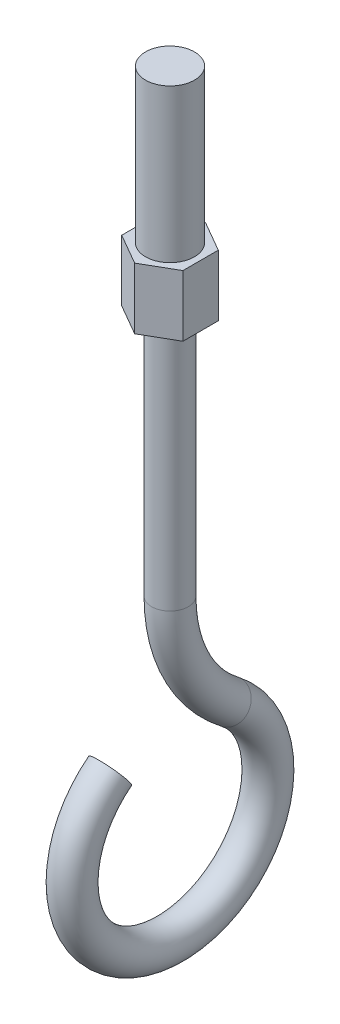
from build123d import *

# Parameters (mm, degrees)
SWEEP1_PROFILE_R    = 3.81
SKETCH32_R          = 5.08
BOSS_EXTRUDE1_DEPTH = 12.7
SKETCH32_2_R        = 5.08
SKETCH32_2_R_2      = 3.81
BOSS_EXTRUDE2_DEPTH = 44.45


with BuildPart() as part:
    # Sweep1: sweep along a path in Sketch1
    with BuildLine(Plane(origin=(0, 0, 0), x_dir=(0, 0, -1), z_dir=(1, 0, 0))) as sweep1_path:
        Line((0, 0), (0, -50.8))
        ThreePointArc((0, -50.8), (3.265488804, -64.824803812), (12.390243902, -75.964704327))
        ThreePointArc((12.390243902, -75.964704327), (0, -112.390115096), (-12.390243902, -75.964704327))
    # Sweep1 profile (on start of the path) → Sweep1 (sweep)
    with BuildSketch(Plane(origin=(0, 0, 0), x_dir=(0, 0, -1), z_dir=(0, -1, 0))):
        Circle(SWEEP1_PROFILE_R)
    sweep(path=sweep1_path.line)



with BuildPart() as body_2:
    # Sketch32 → Boss-Extrude1 (new body)
    with BuildSketch(Plane(origin=(0, 0, 0), x_dir=(1, 0, 0), z_dir=(0, 1, 0))):
        Polygon((6.35, 3.666174209), (0, 7.332348419), (-6.35, 3.666174209), (-6.35, -3.666174209), (0, -7.332348419), (6.35, -3.666174209), align=None)
        with Locations(Location((0, 0, 0), (0, 0, 90))):
            Circle(SKETCH32_R, mode=Mode.SUBTRACT)
    extrude(amount=BOSS_EXTRUDE1_DEPTH)


with BuildPart() as part_1:
    add(part.part)

    add(body_2.part)  # Boss-Extrude2 merges body 2
    # Sketch32<2> → Boss-Extrude2 (add)
    # profile 1 of 2: a face of its own
    with BuildSketch(Plane(origin=(0, 0, 0), x_dir=(1, 0, 0), z_dir=(0, 1, 0))):
        with Locations(Location((0, 0, 0), (0, 0, 270))):
            Circle(SKETCH32_2_R)
        with Locations(Location((0, 0, 0), (0, 0, 270))):
            Circle(SKETCH32_2_R_2, mode=Mode.SUBTRACT)
    # profile 2 of 2: a face of its own
    with BuildSketch(Plane(origin=(0, 0, 0), x_dir=(1, 0, 0), z_dir=(0, 1, 0))):
        with Locations(Location((0, 0, 0), (0, 0, 270))):
            Circle(SKETCH32_2_R_2)
    extrude(amount=BOSS_EXTRUDE2_DEPTH)


solid = part_1.part
